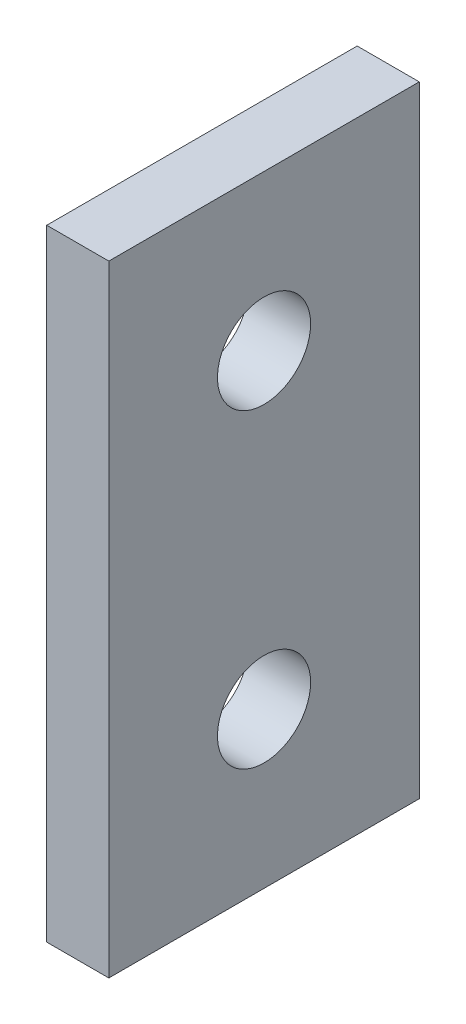
from build123d import *

# Parameters (mm, degrees)
SKETCH1_W           = 10
SKETCH1_H           = 20
SKETCH1_R           = 1.5
BOSS_EXTRUDE1_DEPTH = 2


with BuildPart() as part:
    # Sketch1 → Boss-Extrude1 (new body)
    with BuildSketch(Plane(origin=(0, 0, 0), x_dir=(0, 0, -1), z_dir=(1, 0, 0))):
        Rectangle(SKETCH1_W, SKETCH1_H)
        with Locations((0, 5)):
            Circle(SKETCH1_R, mode=Mode.SUBTRACT)
        with Locations((0, -5)):
            Circle(SKETCH1_R, mode=Mode.SUBTRACT)
    extrude(amount=BOSS_EXTRUDE1_DEPTH)


solid = part.part
